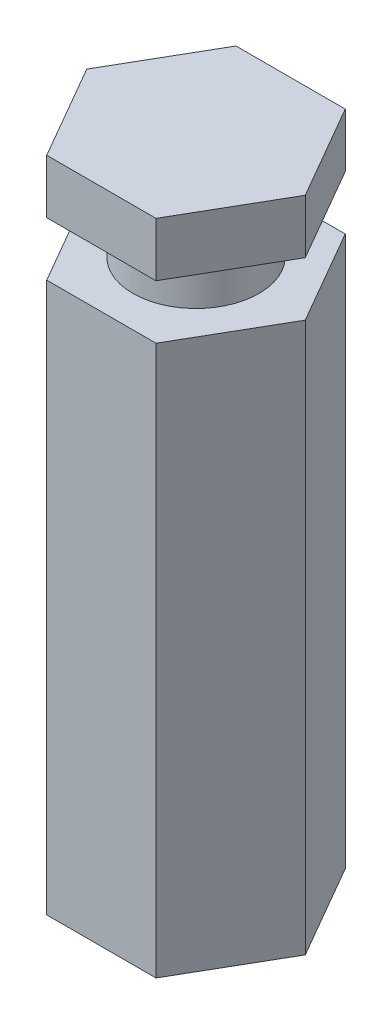
from build123d import *

# Parameters (mm, degrees)
DODANIE_WYCI_GNI_CIE1_DEPTH = 61
SZKIC3_R                    = 7
DODANIE_WYCI_GNI_CIE2_DEPTH = 6
DODANIE_WYCI_GNI_CIE3_DEPTH = 6


with BuildPart() as part:
    # Szkic2 → Dodanie-wyciągnięcie1 (new body)
    with BuildSketch(Plane(origin=(0, 0, 0), x_dir=(1, 0, 0), z_dir=(0, 1, 0))):
        Polygon((12.124355653, 0), (6.062177826, 10.5), (-6.062177826, 10.5), (-12.124355653, 0), (-6.062177826, -10.5), (6.062177826, -10.5), align=None)
    extrude(amount=DODANIE_WYCI_GNI_CIE1_DEPTH)

    # Szkic3 → Dodanie-wyciągnięcie2 (add)
    with BuildSketch(Plane(origin=(0, 61, 0), x_dir=(1, 0, 0), z_dir=(0, 1, 0))):
        with Locations(Location((0, 0, 0), (0, 0, 270))):
            Circle(SZKIC3_R)
    extrude(amount=DODANIE_WYCI_GNI_CIE2_DEPTH)

    # Szkic4 → Dodanie-wyciągnięcie3 (add)
    with BuildSketch(Plane(origin=(0, 67, 0), x_dir=(1, 0, 0), z_dir=(0, 1, 0))):
        Polygon((12.124355653, 0), (6.062177826, 10.5), (-6.062177826, 10.5), (-12.124355653, 0), (-6.062177826, -10.5), (6.062177826, -10.5), align=None)
    extrude(amount=DODANIE_WYCI_GNI_CIE3_DEPTH)


solid = part.part
